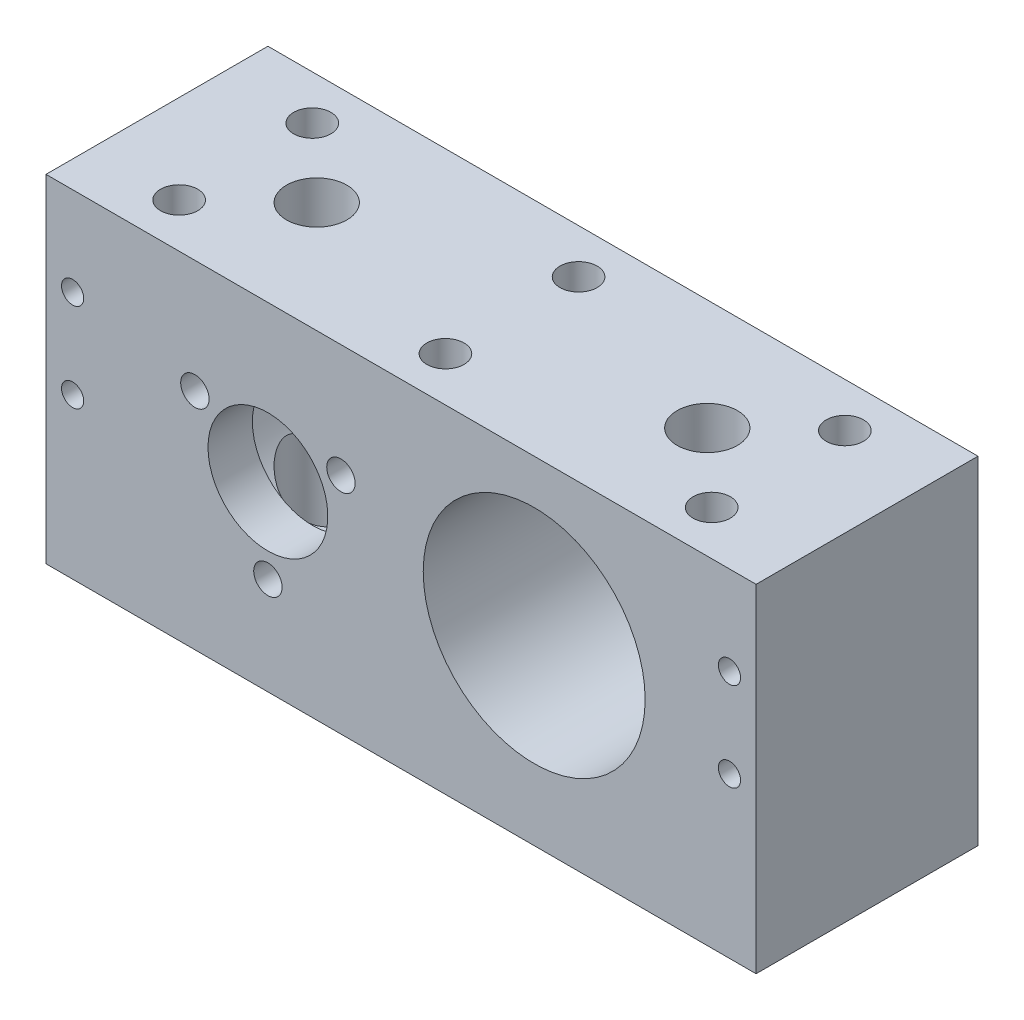
from build123d import *

# Parameters (mm, degrees)
SKETCH_1_W               = 70
SKETCH_1_H               = 35
EXTRUDE_1_DEPTH          = 25
SKETCH_3_R               = 12.5
CUT_EXTRUDE_2_DEPTH      = 20
SKETCH_5_R               = 6.75
CUT_EXTRUDE_4_DEPTH      = 5
SKETCH_6_R               = 1.6
CUT_EXTRUDE_5_DEPTH      = 5
SKETCH_8_R               = 12.5
CUT_EXTRUDE_6_DEPTH      = 20
SKETCH_9_R               = 6.75
CUT_EXTRUDE_7_DEPTH      = 20
SKETCH_10_R              = 1.6
CUT_EXTRUDE_8_DEPTH      = 44.945989578
SKETCH_11_R              = 3.4
CUT_EXTRUDE_9_DEPTH      = 56.452682532
EXTRUDE_START            = 3
SKETCH_13_W              = 70
SKETCH_13_H              = 25
SKETCH_13_R              = 3.4
EXTRUDE_3_DEPTH          = 3
SKETCH_2_R               = 2.1
CUT_EXTRUDE_1_DEPTH      = 58.393379519
SKETCH_15_W              = 25
SKETCH_15_H              = 38
EXTRUDE_4_DEPTH          = 5
SKETCH_16_W              = 25
SKETCH_16_H              = 38
EXTRUDE_5_DEPTH          = 5
SKETCH_17_R              = 2.1
CUT_EXTRUDE_11_DEPTH     = 61.572270988
SKETCH_18_R              = 1.25
CUT_EXTRUDE_12_DEPTH     = 5
MIRROR_2_COPY_1_SKETCH_R = 1.25
MIRROR_2_COPY_1_DEPTH    = 5


with BuildPart() as part:
    # 草图1 → 凸台-拉伸1 (new body)
    with BuildSketch(Plane.XY):
        Rectangle(SKETCH_1_W, SKETCH_1_H)
    extrude(amount=EXTRUDE_1_DEPTH)

    # 草图3 → 切除-拉伸2 (cut)
    with BuildSketch(Plane(origin=(0, 0, 0), x_dir=(-1, 0, 0), z_dir=(0, 0, -1))):
        with Locations((15, 0)):
            Circle(SKETCH_3_R)
    extrude(amount=-CUT_EXTRUDE_2_DEPTH, mode=Mode.SUBTRACT)

    # 草图5 → 切除-拉伸4 (cut)
    with BuildSketch(Plane(origin=(0, 0, 20), x_dir=(-1, 0, 0), z_dir=(0, 0, -1))):
        with Locations((15, 0)):
            Circle(SKETCH_5_R)
    extrude(amount=-CUT_EXTRUDE_4_DEPTH, mode=Mode.SUBTRACT)

    # 草图6 → 切除-拉伸5 (cut)
    with BuildSketch(Plane(origin=(0, 0, 20), x_dir=(-1, 0, 0), z_dir=(0, 0, -1))):
        with Locations((15, -9.5)):
            Circle(SKETCH_6_R)
        with Locations((6.772758664, 4.75)):
            Circle(SKETCH_6_R)
        with Locations((23.227241336, 4.75)):
            Circle(SKETCH_6_R)
    extrude(amount=-CUT_EXTRUDE_5_DEPTH, mode=Mode.SUBTRACT)

    # 草图8 → 切除-拉伸6 (cut)
    with BuildSketch(Plane.XY.offset(25)):
        with Locations((15, 0)):
            Circle(SKETCH_8_R)
    extrude(amount=-CUT_EXTRUDE_6_DEPTH, mode=Mode.SUBTRACT)

    # 草图9 → 切除-拉伸7 (cut)
    with BuildSketch(Plane.XY.offset(5)):
        with Locations((15, 0)):
            Circle(SKETCH_9_R)
    extrude(amount=-CUT_EXTRUDE_7_DEPTH, mode=Mode.SUBTRACT)

    # 草图10 → 切除-拉伸8 (cut, through all)
    with BuildSketch(Plane.XY.offset(5)):
        with Locations((15, -9.5)):
            Circle(SKETCH_10_R)
        with Locations((6.772758664, 4.75)):
            Circle(SKETCH_10_R)
        with Locations((23.227241336, 4.75)):
            Circle(SKETCH_10_R)
    extrude(amount=-CUT_EXTRUDE_8_DEPTH, mode=Mode.SUBTRACT)

    # 草图11 → 切除-拉伸9 (cut, through all)
    with BuildSketch(Plane.XZ.offset(17.5)):
        with Locations(Location((22, 12.5, 0), (0, 0, 270))):
            Circle(SKETCH_11_R)
        with Locations(Location((-22, 12.5, 0), (0, 0, 270))):
            Circle(SKETCH_11_R)
    extrude(amount=-CUT_EXTRUDE_9_DEPTH, mode=Mode.SUBTRACT)

    # 草图13 → 凸台-拉伸3 (add)
    with BuildSketch(Plane.XZ.offset(17.5).offset(EXTRUDE_START)):
        with Locations((0, 12.5)):
            Rectangle(SKETCH_13_W, SKETCH_13_H)
        with Locations(Location((-22, 12.5, 0), (0, 0, 270))):
            Circle(SKETCH_13_R, mode=Mode.SUBTRACT)
        with Locations(Location((22, 12.5, 0), (0, 0, 270))):
            Circle(SKETCH_13_R, mode=Mode.SUBTRACT)
    extrude(amount=-EXTRUDE_3_DEPTH)

    # 草图2 → 切除-拉伸1 (cut, through all)
    with BuildSketch(Plane(origin=(0, 17.5, 0), x_dir=(1, 0, 0), z_dir=(0, 1, 0))):
        with Locations(Location((30, -5, 0), (0, 0, 270))):
            Circle(SKETCH_2_R)
        with Locations(Location((30, -20, 0), (0, 0, 270))):
            Circle(SKETCH_2_R)
        with Locations(Location((-30, -5, 0), (0, 0, 270))):
            Circle(SKETCH_2_R)
        with Locations(Location((-30, -20, 0), (0, 0, 270))):
            Circle(SKETCH_2_R)
    extrude(amount=-CUT_EXTRUDE_1_DEPTH, mode=Mode.SUBTRACT)

    # 草图15 → 凸台-拉伸4 (add)
    with BuildSketch(Plane.ZY.offset(35)):
        with Locations((12.5, -1.5)):
            Rectangle(SKETCH_15_W, SKETCH_15_H)
    extrude(amount=EXTRUDE_4_DEPTH)

    # 草图16 → 凸台-拉伸5 (add)
    with BuildSketch(Plane(origin=(35, 0, 0), x_dir=(0, 0, -1), z_dir=(1, 0, 0))):
        with Locations((-12.5, -1.5)):
            Rectangle(SKETCH_16_W, SKETCH_16_H)
    extrude(amount=EXTRUDE_5_DEPTH)

    # 草图17 → 切除-拉伸11 (cut, through all)
    with BuildSketch(Plane.XZ.offset(20.5)):
        with Locations(Location((0, 5, 0), (0, 0, 270))):
            Circle(SKETCH_17_R)
        with Locations(Location((0, 20, 0), (0, 0, 90))):
            Circle(SKETCH_17_R)
    extrude(amount=-CUT_EXTRUDE_11_DEPTH, mode=Mode.SUBTRACT)

    # 草图18 → 切除-拉伸12 (cut)
    with BuildSketch(Plane(origin=(0, 0, 0), x_dir=(-1, 0, 0), z_dir=(0, 0, -1))):
        with Locations((-37, 7.5)):
            Circle(SKETCH_18_R)
        with Locations((-37, -2.5)):
            Circle(SKETCH_18_R)
    cut_extrude_12 = extrude(amount=-CUT_EXTRUDE_12_DEPTH, mode=Mode.SUBTRACT)

    # 镜向1: 切除-拉伸12 across plane
    add(cut_extrude_12.mirror(Plane.XY.offset(12.5)), mode=Mode.SUBTRACT)

    # 镜向2: 切除-拉伸12 across plane
    add(cut_extrude_12.mirror(Plane(origin=(0, 0, 0), x_dir=(0, 0, 1), z_dir=(1, 0, 0))), mode=Mode.SUBTRACT)

    # 镜向2 copy 1 sketch → 镜向2 copy 1 (cut)
    with BuildSketch(Plane.XY.offset(25)):
        with Locations((-37, 7.5)):
            Circle(MIRROR_2_COPY_1_SKETCH_R)
        with Locations((-37, -2.5)):
            Circle(MIRROR_2_COPY_1_SKETCH_R)
    extrude(amount=-MIRROR_2_COPY_1_DEPTH, mode=Mode.SUBTRACT)


solid = part.part
